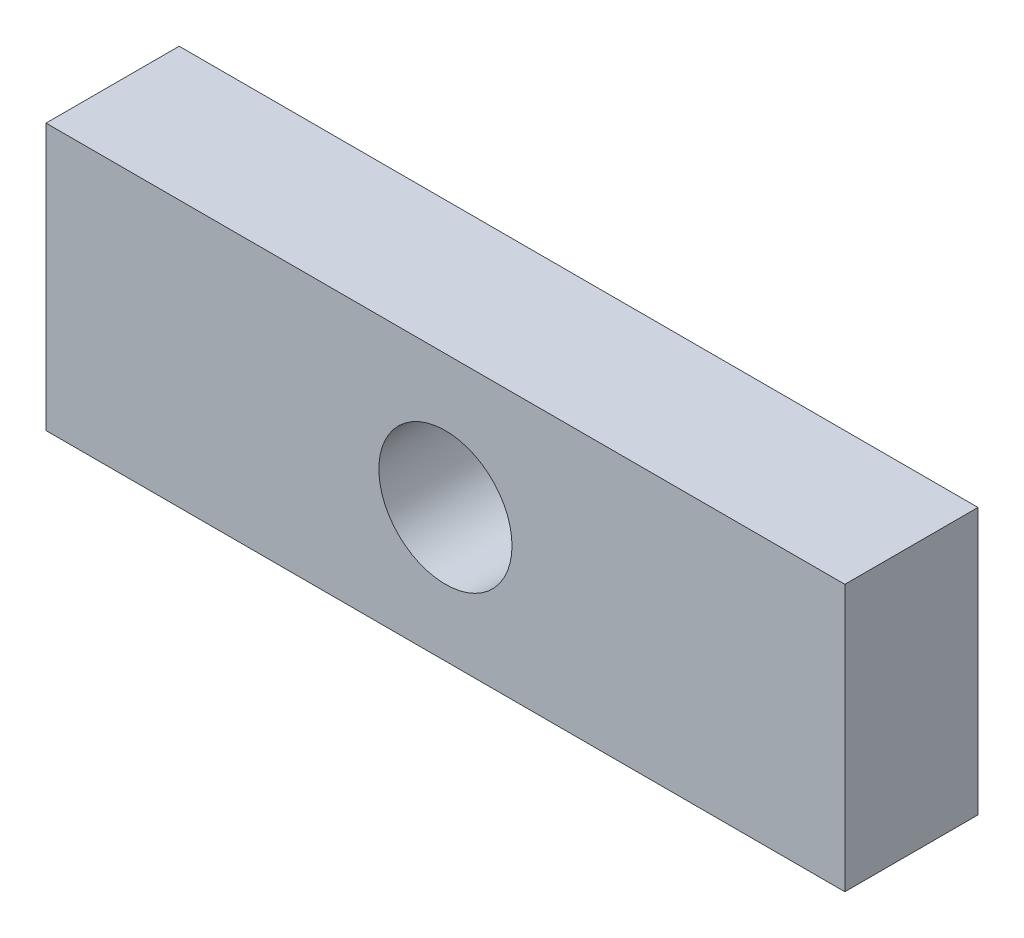
from build123d import *

# Parameters (mm, degrees)
SKETCH1_W           = 60
SKETCH1_H           = 20
SKETCH1_R           = 5
BOSS_EXTRUDE1_DEPTH = 10


with BuildPart() as part:
    # Sketch1 → Boss-Extrude1 (new body)
    with BuildSketch(Plane.XY):
        Rectangle(SKETCH1_W, SKETCH1_H)
        Circle(SKETCH1_R, mode=Mode.SUBTRACT)
    extrude(amount=BOSS_EXTRUDE1_DEPTH)


solid = part.part
